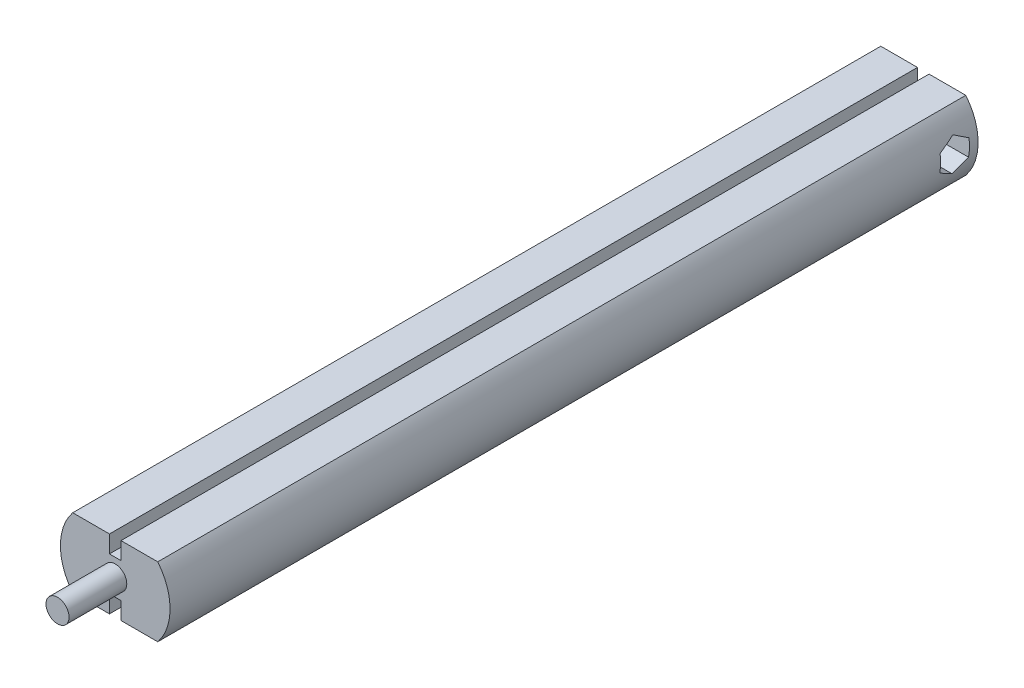
from build123d import *

# Parameters (mm, degrees)
SKETCH1_R           = 4.75
BOSS_EXTRUDE1_DEPTH = 70
CUT_EXTRUDE1_DEPTH  = 10
CUT_EXTRUDE2_DEPTH  = 71.39132475
CUT_EXTRUDE3_REACH  = 72.322
SKETCH5_W           = 1
SKETCH5_H           = 70
CUT_EXTRUDE4_DEPTH  = 1.5
SKETCH6_R           = 1
BOSS_EXTRUDE2_DEPTH = 5


with BuildPart() as part:
    # Sketch1 → Boss-Extrude1 (new body)
    with BuildSketch(Plane.XY):
        Circle(SKETCH1_R)
    extrude(amount=BOSS_EXTRUDE1_DEPTH)

    # Sketch2 → Cut-Extrude1 (cut)
    with BuildSketch(Plane(origin=(0, 0, 0), x_dir=(-1, 0, 0), z_dir=(0, 0, -1))):
        with BuildLine():
            Line((-0.94, 1.535057002), (-0.94, -1.535057002))
            ThreePointArc((-0.94, -1.535057002), (1.8, 0), (-0.94, 1.535057002))
        make_face()
    extrude(amount=-CUT_EXTRUDE1_DEPTH, mode=Mode.SUBTRACT)

    # Sketch3 → Cut-Extrude2 (cut, through all)
    with BuildSketch(Plane.ZY.offset(-0.94)):
        Polygon((3.230708553, 0.754115238), (1.962271323, 1.44288249), (0.73156277, 0.688767252), (0.769291447, -0.754115238), (2.037728677, -1.44288249), (3.26843723, -0.688767252), align=None)
    extrude(amount=-CUT_EXTRUDE2_DEPTH, mode=Mode.SUBTRACT)

    # Sketch4 → Cut-Extrude3 (cut, up to next)
    with BuildSketch(Plane(origin=(0, 0, 0), x_dir=(-1, 0, 0), z_dir=(0, 0, -1)), mode=Mode.PRIVATE) as cut_extrude3_sk1:
        with BuildLine():
            Line((-3.682729966, 3), (3.682729966, 3))
            ThreePointArc((3.682729966, 3), (0, 4.75), (-3.682729966, 3))
        make_face()
    cut_extrude3_tool1 = extrude(cut_extrude3_sk1.sketch, amount=-CUT_EXTRUDE3_REACH, mode=Mode.PRIVATE) & part.part
    # Sketch4 → Cut-Extrude3 (cut, up to next)
    with BuildSketch(Plane(origin=(0, 0, 0), x_dir=(-1, 0, 0), z_dir=(0, 0, -1)), mode=Mode.PRIVATE) as cut_extrude3_sk2:
        with BuildLine():
            Line((-3.682729966, -3), (3.682729966, -3))
            ThreePointArc((3.682729966, -3), (0, -4.75), (-3.682729966, -3))
        make_face()
    cut_extrude3_tool2 = extrude(cut_extrude3_sk2.sketch, amount=-CUT_EXTRUDE3_REACH, mode=Mode.PRIVATE) & part.part
    add(cut_extrude3_tool1.solids().sort_by_distance((0, 3.712383, 0))[0], mode=Mode.SUBTRACT)
    add(cut_extrude3_tool2.solids().sort_by_distance((0, -3.712383, 0))[0], mode=Mode.SUBTRACT)

    # Sketch5 → Cut-Extrude4 (cut)
    with BuildSketch(Plane(origin=(0, 3, 0), x_dir=(1, 0, 0), z_dir=(0, 1, 0))):
        with Locations((0, -35)):
            Rectangle(SKETCH5_W, SKETCH5_H)
    cut_extrude4 = extrude(amount=-CUT_EXTRUDE4_DEPTH, mode=Mode.SUBTRACT)

    # Mirror1: Cut-Extrude4 across plane
    add(cut_extrude4.mirror(Plane.ZX), mode=Mode.SUBTRACT)

    # Sketch6 → Boss-Extrude2 (add)
    with BuildSketch(Plane.XY.offset(70)):
        Circle(SKETCH6_R)
    extrude(amount=BOSS_EXTRUDE2_DEPTH)


solid = part.part
